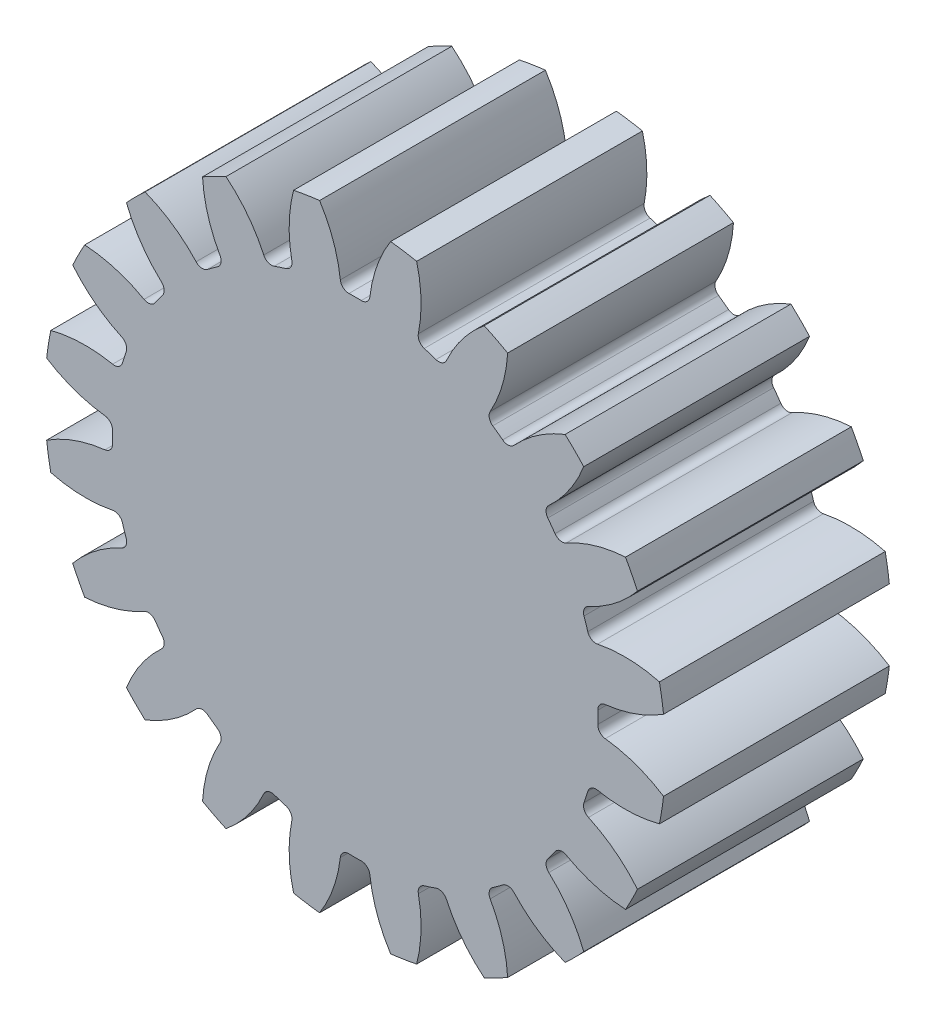
from build123d import *
from build123d.topology import SkipClean

# Parameters (mm, degrees)
SKETCH_3_R                       = 11
EXTRUDE_1_DEPTH                  = 8
CUT_EXTRUDE_1_DEPTH              = 18.492855685
FILLET_1_R                       = 0.3
PATTERN_CIRCULAR_1_COUNT         = 20
FILLET_1_OF_PATTERN_CIRCULAR_1_R = 0.3


with BuildPart() as part:
    # Эскиз3 → Бобышка-Вытянуть1 (new body)
    with BuildSketch(Plane.XY):
        Circle(SKETCH_3_R)
    extrude(amount=EXTRUDE_1_DEPTH)

    # Эскиз5 → Вырез-Вытянуть1 (cut, symmetric)
    with SkipClean():  # the faces are left unmerged after this step: merging them gives an invalid solid
        with BuildSketch(Plane.XY.offset(8)):
            with BuildLine():
                ThreePointArc((2.003514702, 11.831564936), (0, 12), (-2.003514702, 11.831564936))
                ThreePointArc((-2.003514702, 11.831564936), (-1.603683218, 11.402150407), (-1.258371443, 10.927785746))
                ThreePointArc((-1.258371443, 10.927785746), (0, 11), (1.258371443, 10.927785746))
                ThreePointArc((1.258371443, 10.927785746), (1.603683218, 11.402150407), (2.003514702, 11.831564936))
            make_face()
            with BuildLine():
                ThreePointArc((-1.258371443, 10.927785746), (-1.603683218, 11.402150407), (-2.003514702, 11.831564936))
                ThreePointArc((-2.003514702, 11.831564936), (-7.744605334, -9.166301774), (12, 0))
                ThreePointArc((12, 0), (9.166301774, 7.744605334), (2.003514702, 11.831564936))
                ThreePointArc((2.003514702, 11.831564936), (1.603683218, 11.402150407), (1.258371443, 10.927785746))
                ThreePointArc((1.258371443, 10.927785746), (8.211031783, 7.319764823), (11, 0))
                ThreePointArc((11, 0), (-7.319764823, -8.211031783), (-1.258371443, 10.927785746))
            make_face()
            with BuildLine():
                ThreePointArc((1.258371443, 10.927785746), (0, 11), (-1.258371443, 10.927785746))
                ThreePointArc((-1.258371443, 10.927785746), (-0.728262824, 9.805414345), (-0.498977652, 8.585512291))
                ThreePointArc((-0.498977652, 8.585512291), (0, 8.6), (0.498977652, 8.585512291))
                ThreePointArc((0.498977652, 8.585512291), (0.728262824, 9.805414345), (1.258371443, 10.927785746))
            make_face()
        cut_extrude_1 = extrude(amount=CUT_EXTRUDE_1_DEPTH, both=True, mode=Mode.SUBTRACT)

    # Скругление1
    fillet_1_edges = [part.edges().sort_by_distance(p)[0] for p in [
        (-0.498977652, 8.585512291, 4),
        (0.498977652, 8.585512291, 4),
    ]]
    fillet(fillet_1_edges, radius=FILLET_1_R)

    # Круговой массив1: Вырез-Вытянуть1 ×20 about axis
    pattern_circular_1_axis = Axis((0, 0, 0), (0, 0, 1))
    for i in range(1, PATTERN_CIRCULAR_1_COUNT):
        add(cut_extrude_1.rotate(pattern_circular_1_axis, i * 360 / PATTERN_CIRCULAR_1_COUNT), mode=Mode.SUBTRACT)

    # Скругление1 of Круговой массив1
    fillet_1_of_pattern_circular_1_edges = [part.edges().sort_by_distance(p)[0] for p in [
        (-3.12762515, 8.011114836, 4),
        (-2.178513256, 8.319499984, 4),
        (-5.450118908, 6.652533644, 4),
        (-4.642756108, 7.239117054, 4),
        (-7.239117054, 4.642756108, 4),
        (-6.652533644, 5.450118908, 4),
        (-8.319499984, 2.178513256, 4),
        (-8.011114836, 3.12762515, 4),
        (-8.585512291, -0.498977652, 4),
        (-8.585512291, 0.498977652, 4),
        (-8.011114836, -3.12762515, 4),
        (-8.319499984, -2.178513256, 4),
        (-6.652533644, -5.450118908, 4),
        (-7.239117054, -4.642756108, 4),
        (-4.642756108, -7.239117054, 4),
        (-5.450118908, -6.652533644, 4),
        (-2.178513256, -8.319499984, 4),
        (-3.12762515, -8.011114836, 4),
        (0.498977652, -8.585512291, 4),
        (-0.498977652, -8.585512291, 4),
        (3.12762515, -8.011114836, 4),
        (2.178513256, -8.319499984, 4),
        (5.450118908, -6.652533644, 4),
        (4.642756108, -7.239117054, 4),
        (7.239117054, -4.642756108, 4),
        (6.652533644, -5.450118908, 4),
        (8.319499984, -2.178513256, 4),
        (8.011114836, -3.12762515, 4),
        (8.585512291, 0.498977652, 4),
        (8.585512291, -0.498977652, 4),
        (8.011114836, 3.12762515, 4),
        (8.319499984, 2.178513256, 4),
        (6.652533644, 5.450118908, 4),
        (7.239117054, 4.642756108, 4),
        (4.642756108, 7.239117054, 4),
        (5.450118908, 6.652533644, 4),
        (2.178513256, 8.319499984, 4),
        (3.12762515, 8.011114836, 4),
    ]]
    fillet(fillet_1_of_pattern_circular_1_edges, radius=FILLET_1_OF_PATTERN_CIRCULAR_1_R)


solid = part.part
